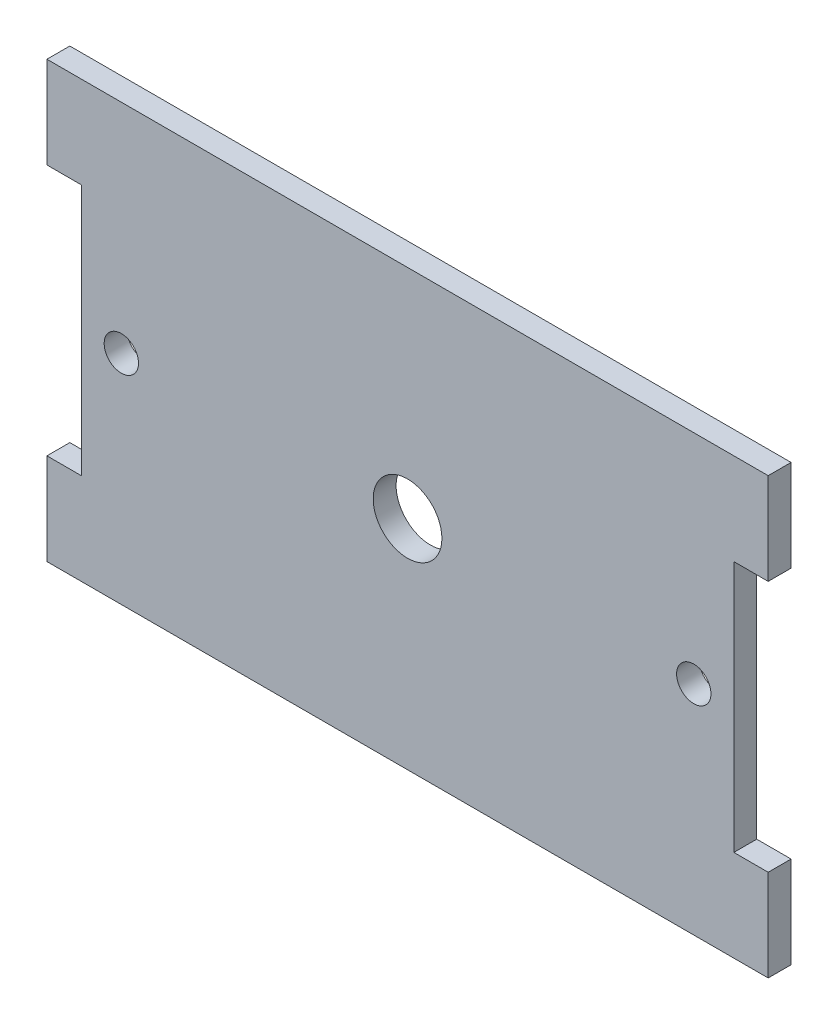
from build123d import *

# Parameters (mm, degrees)
SKETCH_1_R      = 3
SKETCH_1_R_2    = 1.5
EXTRUDE_1_DEPTH = 2


with BuildPart() as part:
    # 草图1 → 凸台-拉伸1 (new body)
    with BuildSketch(Plane.XY):
        Polygon((-13.258857042, -42.872599913), (-16.258857042, -42.872599913), (-16.258857042, -50.872599913), (-13.258857042, -50.872599913), (-13.258857042, -72.872599913), (-16.258857042, -72.872599913), (-16.258857042, -80.872599913), (-13.258857042, -80.872599913), (43.741142958, -80.872599913), (46.741142958, -80.872599913), (46.741142958, -72.872599913), (43.741142958, -72.872599913), (43.741142958, -50.872599913), (46.741142958, -50.872599913), (46.741142958, -42.872599913), (43.741142958, -42.872599913), (15.241142958, -42.872599913), align=None)
        with Locations((15.241142958, -61.872599913)):
            Circle(SKETCH_1_R, mode=Mode.SUBTRACT)
        with Locations((40.241142958, -61.872599913)):
            Circle(SKETCH_1_R_2, mode=Mode.SUBTRACT)
        with Locations(Location((-9.758857042, -61.872599913, 0), (0, 0, 180))):
            Circle(SKETCH_1_R_2, mode=Mode.SUBTRACT)
    extrude(amount=EXTRUDE_1_DEPTH)


solid = part.part
